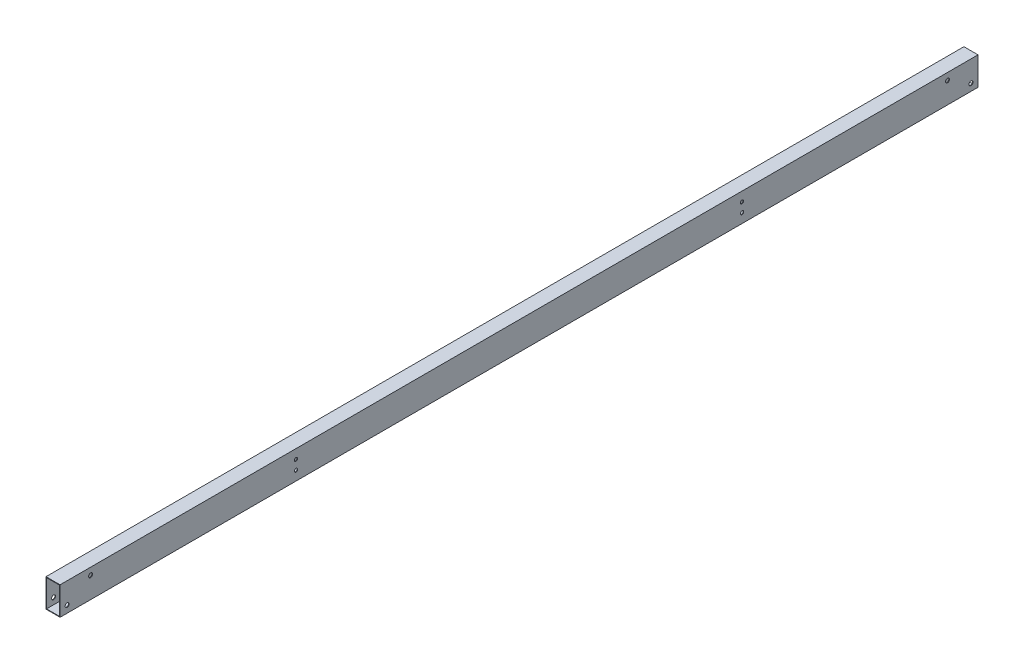
from build123d import *

# Parameters (mm, degrees)
SKETCH1_W           = 30
SKETCH1_H           = 60
SKETCH1_W_2         = 27.6
SKETCH1_H_2         = 57.6
BOSS_EXTRUDE1_DEPTH = 1955
SKETCH4_R           = 3.5
CUT_EXTRUDE3_DEPTH  = 1957.150556578
SKETCH5_R           = 4.25
CUT_EXTRUDE4_DEPTH  = 1957.150556578


with BuildPart() as part:
    # Sketch1 → Boss-Extrude1 (new body)
    with BuildSketch(Plane.XY):
        with Locations((15, 30)):
            Rectangle(SKETCH1_W, SKETCH1_H)
        with Locations((15, 30)):
            Rectangle(SKETCH1_W_2, SKETCH1_H_2, mode=Mode.SUBTRACT)
    extrude(amount=BOSS_EXTRUDE1_DEPTH)

    # Sketch4 → Cut-Extrude3 (cut, through all)
    with BuildSketch(Plane(origin=(30, 0, 0), x_dir=(0, 0, -1), z_dir=(1, 0, 0))):
        with Locations((-1452.5, 40)):
            Circle(SKETCH4_R)
        with Locations((-1452.5, 20)):
            Circle(SKETCH4_R)
        with Locations((-502.5, 40)):
            Circle(SKETCH4_R)
        with Locations((-502.5, 20)):
            Circle(SKETCH4_R)
    extrude(amount=-CUT_EXTRUDE3_DEPTH, mode=Mode.SUBTRACT)

    # Sketch5 → Cut-Extrude4 (cut, through all)
    with BuildSketch(Plane(origin=(30, 0, 0), x_dir=(0, 0, -1), z_dir=(1, 0, 0))):
        with Locations((-15, 15)):
            Circle(SKETCH5_R)
        with Locations((-65, 45)):
            Circle(SKETCH5_R)
        with Locations((-1890, 45)):
            Circle(SKETCH5_R)
        with Locations((-1940, 15)):
            Circle(SKETCH5_R)
    extrude(amount=-CUT_EXTRUDE4_DEPTH, mode=Mode.SUBTRACT)


solid = part.part
